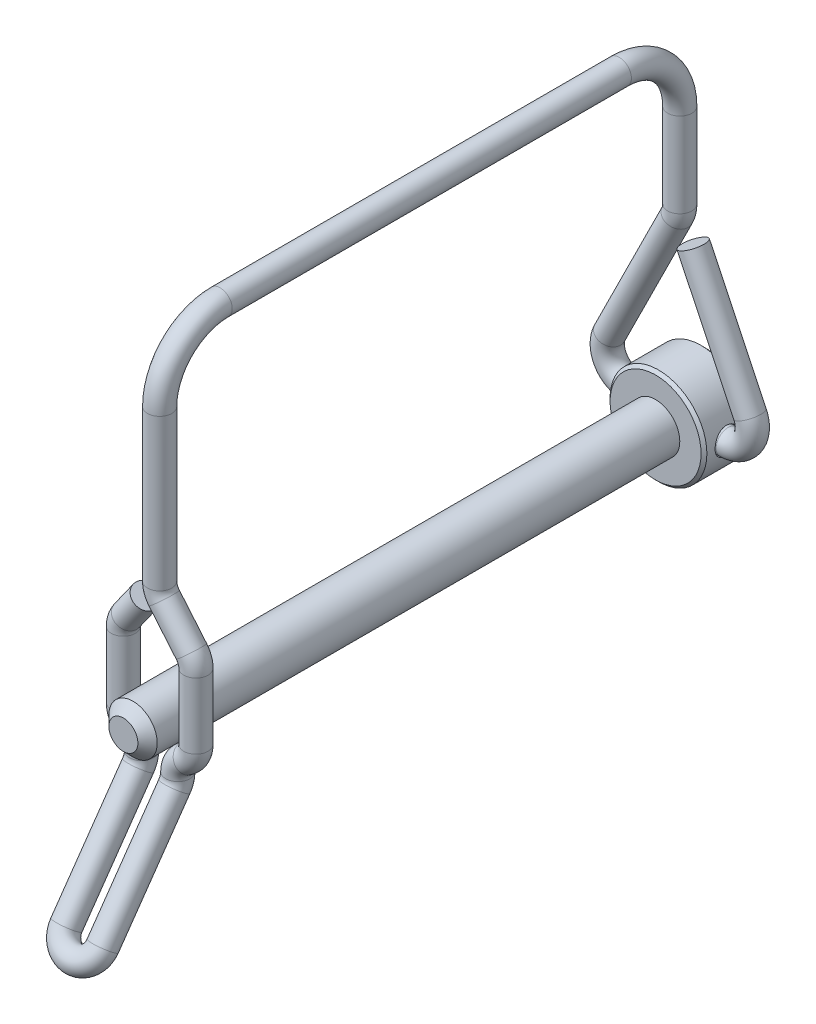
from build123d import *

# Parameters (mm, degrees)
CUT_EXTRUDE1_DEPTH      = 40.144028919
CUT_EXTRUDE1_DEPTH_BACK = 40.144028919
SKETCH2_R               = 1.7145
SKETCH10_R              = 1.5875


with BuildPart() as part:
    # Sketch1 → Revolve1 (revolve)
    with BuildSketch(Plane(origin=(0, 0, 0), x_dir=(0, 0, -1), z_dir=(1, 0, 0)), mode=Mode.PRIVATE) as revolve1_sk:
        Polygon((-38.1, 0), (38.1, 0), (38.1, 5.969), (37.719, 6.35), (32.131, 6.35), (31.75, 5.969), (31.75, 3.175), (-36.83, 3.175), (-38.1, 1.905), align=None)
    revolve(revolve1_sk.sketch.rotate(Axis((0, 0, 38.1), (0, 0, -1)), 90), axis=Axis((0, 0, 38.1), (0, 0, -1)))

    # Sketch2 → Cut-Extrude1 (cut, two sides: drawn at the far end of the back side and taken through both)
    with BuildSketch(Plane(origin=(0, 0, 0), x_dir=(0, 0, -1), z_dir=(1, 0, 0)).offset(-CUT_EXTRUDE1_DEPTH_BACK)):
        with Locations((34.925, 0)):
            Circle(SKETCH2_R)
    extrude(amount=CUT_EXTRUDE1_DEPTH + CUT_EXTRUDE1_DEPTH_BACK, mode=Mode.SUBTRACT)


with BuildPart() as body_2:
    # Sweep1: sweep along a curve in space
    with BuildLine() as sweep1_path:
        Line((-1.836673964, 12.491413374, 33.3375), (-4.294369301, 9.025893897, 33.3375))
        ThreePointArc((-4.294369301, 9.025893897, 33.3375), (-4.642639255, 8.327609839, 33.3375), (-4.7625, 7.556554725, 33.3375))
        Line((-4.7625, 7.556554725, 33.3375), (-4.7625, -1.091312193, 33.3375))
        ThreePointArc((-4.7625, -1.091312193, 33.3375), (-4.445, -2.320984405, 33.3375), (-3.571875, -3.243238564, 33.3375))
        ThreePointArc((-3.571875, -3.243238564, 33.3375), (-2.69875, -4.165492724, 33.3375), (-2.38125, -5.395164936, 33.3375))
        ThreePointArc((-2.38125, -5.395164936, 33.3375), (-2.38125, -6.158957667, 33.455058945), (-2.38125, -6.852049084, 33.796853808))
        Line((-2.38125, -6.852049084, 33.796853808), (-2.38125, -20.274394195, 43.195281034))
        ThreePointArc((-2.38125, -20.274394195, 43.195281034), (0, -22.225, 44.561109923), (2.38125, -20.274394195, 43.195281034))
        Line((2.38125, -20.274394195, 43.195281034), (2.38125, -6.852049084, 33.796853808))
        ThreePointArc((2.38125, -6.852049084, 33.796853808), (2.38125, -6.158957667, 33.455058945), (2.38125, -5.395164936, 33.3375))
        ThreePointArc((2.38125, -5.395164936, 33.3375), (2.69875, -4.165492724, 33.3375), (3.571875, -3.243238564, 33.3375))
        ThreePointArc((3.571875, -3.243238564, 33.3375), (4.445, -2.320984405, 33.3375), (4.7625, -1.091312193, 33.3375))
        Line((4.7625, -1.091312193, 33.3375), (4.7625, 7.556554725, 33.3375))
        ThreePointArc((4.7625, 7.556554725, 33.3375), (4.609319257, 8.425285889, 33.3375), (4.168252886, 9.189235254, 33.3375))
        Line((4.168252886, 9.189235254, 33.3375), (0.594247114, 13.448569471, 33.3375))
        ThreePointArc((0.594247114, 13.448569471, 33.3375), (0.153180743, 14.212518836, 33.3375), (0, 15.08125, 33.3375))
        Line((0, 15.08125, 33.3375), (0, 15.875, 33.3375))
        Line((0, 15.875, 33.3375), (0, 34.925, 33.3375))
        ThreePointArc((0, 34.925, 33.3375), (0, 40.537660076, 31.012660076), (0, 42.8625, 25.4))
        Line((0, 42.8625, 25.4), (0, 42.8625, -26.9875))
        ThreePointArc((0, 42.8625, -26.9875), (0, 40.537660076, -32.600160076), (0, 34.925, -34.925))
        Line((0, 34.925, -34.925), (0, 25.4, -34.925))
        Line((0, 25.4, -34.925), (0, 23.8125, -34.925))
        ThreePointArc((0, 23.8125, -34.925), (-0.084210296, 23.086108918, -34.925), (-0.332374175, 22.398249873, -34.925))
        Line((-0.332374175, 22.398249873, -34.925), (-9.192625825, 4.589250127, -34.925))
        ThreePointArc((-9.192625825, 4.589250127, -34.925), (-9.049154419, 1.5031177, -34.925), (-6.35, 0, -34.925))
        Line((-6.35, 0, -34.925), (6.35, 0, -34.925))
        ThreePointArc((6.35, 0, -34.925), (9.036047851, 1.482140897, -34.925), (9.214315311, 4.544789326, -34.925))
        Line((9.214315311, 4.544789326, -34.925), (1.753330338, 20.146176402, -34.925))
    # Sketch10 → Sweep1 (sweep)
    with BuildSketch(Plane(origin=(-19.295412047, 10.080125872, 0), x_dir=(0, 0, -1), z_dir=(0.43142970912591794, -0.9021465546592339, 0))):
        with Locations((34.925, 23.331843675)):
            Circle(SKETCH10_R)
    sweep(path=sweep1_path.line)


solid = Compound([part.part, body_2.part])
